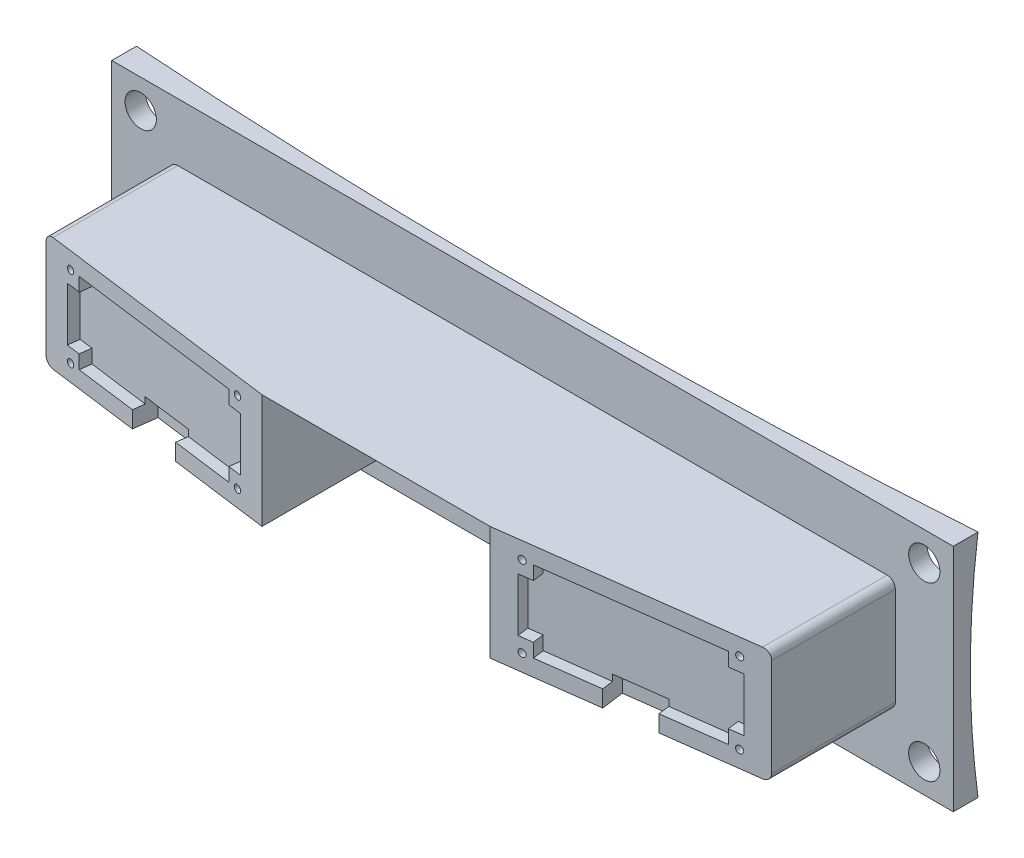
from build123d import *

# Parameters (mm, degrees)
BOSS_EXTRUDE4_DEPTH           = 25
CUT_EXTRUDE2_DEPTH            = 25
TAP_DRILL_FOR_4_40_TAP1_D     = 1.600000102
TAP_DRILL_FOR_4_40_TAP1_DEPTH = 7.874
TAP_DRILL_FOR_4_40_TAP1_TIP   = 0.480688526
TAP_DRILL_FOR_4_40_TAP3_D     = 1.600000102
TAP_DRILL_FOR_4_40_TAP3_DEPTH = 7.874
TAP_DRILL_FOR_4_40_TAP3_TIP   = 0.480688526
TAP_DRILL_FOR_4_40_TAP4_D     = 1.600000102
TAP_DRILL_FOR_4_40_TAP4_DEPTH = 7.874
TAP_DRILL_FOR_4_40_TAP4_TIP   = 0.480688526
FILLET1_R                     = 1.778
CUT_EXTRUDE3_DEPTH            = 2.5
CUT_EXTRUDE4_DEPTH            = 2.5
CUT_EXTRUDE5_DEPTH            = 2.5
SKETCH23_W                    = 11
SKETCH23_H                    = 5.045
CUT_EXTRUDE6_DEPTH            = 5
SKETCH24_W                    = 11
SKETCH24_H                    = 5.045
CUT_EXTRUDE7_DEPTH            = 5
SKETCH25_W                    = 11
SKETCH25_H                    = 16.07506189
CUT_EXTRUDE8_DEPTH            = 10
SKETCH26_W                    = 184.458934752
SKETCH26_H                    = 50.4
BOSS_EXTRUDE6_DEPTH           = 29.21
SKETCH27_R                    = 3.429
CUT_EXTRUDE9_DEPTH            = 106.37252383


with BuildPart() as part:
    # Sketch6 → Boss-Extrude4 (new body)
    with BuildSketch(Plane(origin=(0, 0, 0), x_dir=(1, 0, 0), z_dir=(0, 1, 0))):
        Polygon((-79.529467376, 0), (79.529467376, 0), (79.529467376, -56.321059428), (25, -63.5), (-25, -63.5), (-79.529467376, -56.321059428), align=None)
    extrude(amount=BOSS_EXTRUDE4_DEPTH)

    # Sketch7 → Cut-Extrude2 (cut, symmetric)
    with BuildSketch(Plane(origin=(0, 0, 0), x_dir=(0, 0, -1), z_dir=(1, 0, 0))):
        Polygon((-63.5, 25), (-38.5, 0), (-63.5, 0), align=None)
    extrude(amount=CUT_EXTRUDE2_DEPTH, both=True, mode=Mode.SUBTRACT)

    # Tap Drill for #4-40 Tap1
    with Locations(Plane(origin=(0, -19.25, 19.25), x_dir=(-1, 0, 0), z_dir=(0, -0.7071067811865488, 0.7071067811865462))):
        with Locations((-21.255000035, -53.756280605), (21.255000035, -53.756280605), (21.255000035, -36.046280605), (-21.255000035, -36.046280605)):
            Hole(TAP_DRILL_FOR_4_40_TAP1_D / 2, depth=TAP_DRILL_FOR_4_40_TAP1_DEPTH)
            with Locations((0, 0, -(TAP_DRILL_FOR_4_40_TAP1_DEPTH + TAP_DRILL_FOR_4_40_TAP1_TIP / 2))):  # 118° drill point
                Cone(0, TAP_DRILL_FOR_4_40_TAP1_D / 2, TAP_DRILL_FOR_4_40_TAP1_TIP, mode=Mode.SUBTRACT)

    # Tap Drill for #4-40 Tap3
    with Locations(Plane(origin=(-8.643431853, 0, 65.653383048), x_dir=(0.9914448613738104, 0, 0.13052619222005213), z_dir=(-0.13052619222005213, 0, 0.9914448613738104))):
        with Locations((-65.252708328, 21.355), (-22.742708328, 21.355), (-22.742708328, 3.645), (-65.252708328, 3.645)):
            Hole(TAP_DRILL_FOR_4_40_TAP3_D / 2, depth=TAP_DRILL_FOR_4_40_TAP3_DEPTH)
            with Locations((0, 0, -(TAP_DRILL_FOR_4_40_TAP3_DEPTH + TAP_DRILL_FOR_4_40_TAP3_TIP / 2))):  # 118° drill point
                Cone(0, TAP_DRILL_FOR_4_40_TAP3_D / 2, TAP_DRILL_FOR_4_40_TAP3_TIP, mode=Mode.SUBTRACT)

    # Tap Drill for #4-40 Tap4
    with Locations(Plane(origin=(8.643431853, 0, 65.653383048), x_dir=(0.9914448613738104, 0, -0.13052619222005213), z_dir=(0.13052619222005213, 0, 0.9914448613738104))):
        with Locations((22.742708328, 21.355), (65.252708328, 21.355), (65.252708328, 3.645), (22.742708328, 3.645)):
            Hole(TAP_DRILL_FOR_4_40_TAP4_D / 2, depth=TAP_DRILL_FOR_4_40_TAP4_DEPTH)
            with Locations((0, 0, -(TAP_DRILL_FOR_4_40_TAP4_DEPTH + TAP_DRILL_FOR_4_40_TAP4_TIP / 2))):  # 118° drill point
                Cone(0, TAP_DRILL_FOR_4_40_TAP4_D / 2, TAP_DRILL_FOR_4_40_TAP4_TIP, mode=Mode.SUBTRACT)

    # Fillet1
    fillet1_edges = [part.edges().sort_by_distance(p)[0] for p in [
        (-79.529467376, 25, 28.160529714),
        (79.529467376, 25, 28.160529714),
        (-79.529467376, 0, 28.160529714),
        (79.529467376, 0, 28.160529714),
    ]]
    fillet(fillet1_edges, radius=FILLET1_R)

    # Sketch22 → Cut-Extrude3 (cut)
    with BuildSketch(Plane(origin=(0, -19.25, 19.25), x_dir=(1, 0, 0), z_dir=(0, -0.7071067811865488, 0.7071067811865462))):
        Polygon((-19.055000086, 53.756280605), (-19.055000086, 50.756280605), (-22.055000086, 50.756280605), (-22.055000086, 39.046280605), (-19.055000086, 39.046280605), (-19.055000086, 36.046280605), (19.055000086, 36.046280605), (19.055000086, 39.046280605), (22.055000086, 39.046280605), (22.055000086, 50.756280605), (19.055000086, 50.756280605), (19.055000086, 53.756280605), align=None)
    extrude(amount=-CUT_EXTRUDE3_DEPTH, mode=Mode.SUBTRACT)

    # Sketch21 → Cut-Extrude4 (cut)
    with BuildSketch(Plane(origin=(8.643431853, 0, 65.653383048), x_dir=(0.9914448613738104, 0, -0.13052619222005213), z_dir=(0.13052619222005213, 0, 0.9914448613738104))):
        Polygon((24.942708277, 21.355), (24.942708277, 18.355), (21.942708277, 18.355), (21.942708277, 6.645), (24.942708277, 6.645), (24.942708277, 3.645), (63.052708379, 3.645), (63.052708379, 6.645), (66.052708379, 6.645), (66.052708379, 18.355), (63.052708379, 18.355), (63.052708379, 21.355), align=None)
    extrude(amount=-CUT_EXTRUDE4_DEPTH, mode=Mode.SUBTRACT)

    # Sketch20 → Cut-Extrude5 (cut)
    with BuildSketch(Plane(origin=(-8.643431853, 0, 65.653383048), x_dir=(0.9914448613738104, 0, 0.13052619222005213), z_dir=(-0.13052619222005213, 0, 0.9914448613738104))):
        Polygon((-63.052708379, 21.355), (-63.052708379, 18.355), (-66.052708379, 18.355), (-66.052708379, 6.645), (-63.052708379, 6.645), (-63.052708379, 3.645), (-24.942708277, 3.645), (-24.942708277, 6.645), (-21.942708277, 6.645), (-21.942708277, 18.355), (-24.942708277, 18.355), (-24.942708277, 21.355), align=None)
    extrude(amount=-CUT_EXTRUDE5_DEPTH, mode=Mode.SUBTRACT)

    # Sketch23 → Cut-Extrude6 (cut)
    with BuildSketch(Plane(origin=(8.643431853, 0, 65.653383048), x_dir=(0.9914448613738104, 0, -0.13052619222005213), z_dir=(0.13052619222005213, 0, 0.9914448613738104))):
        with Locations((43.997708328, 2.5225)):
            Rectangle(SKETCH23_W, SKETCH23_H)
    extrude(amount=-CUT_EXTRUDE6_DEPTH, mode=Mode.SUBTRACT)

    # Sketch24 → Cut-Extrude7 (cut)
    with BuildSketch(Plane(origin=(-8.643431853, 0, 65.653383048), x_dir=(0.9914448613738104, 0, 0.13052619222005213), z_dir=(-0.13052619222005213, 0, 0.9914448613738104))):
        with Locations((-43.997708328, 2.5225)):
            Rectangle(SKETCH24_W, SKETCH24_H)
    extrude(amount=-CUT_EXTRUDE7_DEPTH, mode=Mode.SUBTRACT)

    # Sketch25 → Cut-Extrude8 (cut)
    with BuildSketch(Plane(origin=(0, -19.25, 19.25), x_dir=(1, 0, 0), z_dir=(0, -0.7071067811865488, 0.7071067811865462))):
        with Locations((0, 29.40874966)):
            Rectangle(SKETCH25_W, SKETCH25_H)
    extrude(amount=-CUT_EXTRUDE8_DEPTH, mode=Mode.SUBTRACT)

    # Sketch26 → Boss-Extrude6 (add)
    with BuildSketch(Plane(origin=(0, 0, 0), x_dir=(-1, 0, 0), z_dir=(0, 0, -1))):
        with Locations((0, 12.5)):
            Rectangle(SKETCH26_W, SKETCH26_H)
    extrude(amount=-BOSS_EXTRUDE6_DEPTH)

    # Sketch11 → Cut-Revolve4 (revolve, cut)
    with BuildSketch(Plane(origin=(0, 0, 0), x_dir=(0, 0, -1), z_dir=(1, 0, 0))):
        with BuildLine():
            Line((1344.295, -496.77), (1344.295, 521.77))
            add(Edge.make_bspline(
                [(1344.295, 521.77), (-28.575, 521.77), (-28.575, 12.5), (-28.575, -496.77), (1344.295, -496.77)],
                knots=[4.71238898, 4.71238898, 4.71238898, 6.283185307, 6.283185307, 7.853981634, 7.853981634, 7.853981634], degree=2, weights=[1, 0.707106781, 1, 0.707106781, 1]))
        make_face()
    revolve(axis=Axis((0, -496.77, -1344.295), (0, 1, 0)), mode=Mode.SUBTRACT)

    # Sketch27 → Cut-Extrude9 (cut, through all)
    with BuildSketch(Plane.XY.offset(29.21)):
        with Locations((85.879467376, -6.35)):
            Circle(SKETCH27_R)
        with Locations((-85.879467376, -6.35)):
            Circle(SKETCH27_R)
        with Locations((-85.879467376, 31.35)):
            Circle(SKETCH27_R)
        with Locations((85.879467376, 31.35)):
            Circle(SKETCH27_R)
    extrude(amount=-CUT_EXTRUDE9_DEPTH, mode=Mode.SUBTRACT)


solid = part.part
